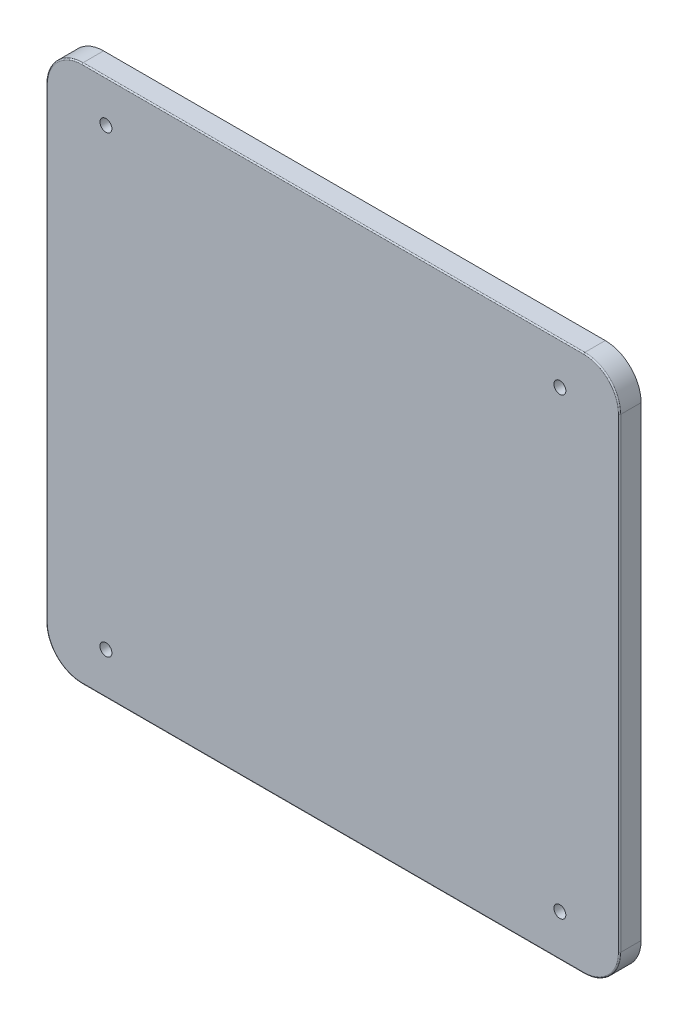
from build123d import *

# Parameters (mm, degrees)
P_IDAT_VYSUNUT_M1_DEPTH      = 18
D_RY_PRO_KOL_K_10_0MM1_D     = 10
D_RY_PRO_KOL_K_10_0MM1_DEPTH = 10
D_RY_PRO_KOL_K_10_0MM1_TIP   = 3.004303095
ZAOBLIT1_R                   = 30
ZAOBLIT2_R                   = 1


with BuildPart() as part:
    # Skica1 → Přidat vysunutím1 (new body)
    with BuildSketch(Plane.XY):
        with BuildLine():
            Line((-210, 225), (210, 225))
            ThreePointArc((210, 225), (231.213203436, 216.213203436), (240, 195))
            Line((240, 195), (240, -195))
            ThreePointArc((240, -195), (231.213203436, -216.213203436), (210, -225))
            Line((210, -225), (-240, -225))
            Line((-240, -225), (-240, 195))
            ThreePointArc((-240, 195), (-231.213203436, 216.213203436), (-210, 225))
        make_face()
    extrude(amount=P_IDAT_VYSUNUT_M1_DEPTH)

    # Díry pro kolík, Ø10.0mm1
    with Locations(Plane.XY.offset(18)):
        with Locations((-190, 190), (190, 190), (190, -190), (-190, -190)):
            Hole(D_RY_PRO_KOL_K_10_0MM1_D / 2, depth=D_RY_PRO_KOL_K_10_0MM1_DEPTH)
            with Locations((0, 0, -(D_RY_PRO_KOL_K_10_0MM1_DEPTH + D_RY_PRO_KOL_K_10_0MM1_TIP / 2))):  # 118° drill point
                Cone(0, D_RY_PRO_KOL_K_10_0MM1_D / 2, D_RY_PRO_KOL_K_10_0MM1_TIP, mode=Mode.SUBTRACT)

    # Zaoblit1
    zaoblit1_edges = [part.edges().sort_by_distance(p)[0] for p in [
        (-240, -225, 9),
    ]]
    fillet(zaoblit1_edges, radius=ZAOBLIT1_R)

    # Zaoblit2
    zaoblit2_edges = [part.edges().sort_by_distance(p)[0] for p in [
        (240, 0, 18),
        (231.213203436, 216.213203436, 18),
        (0, 225, 18),
        (-231.213203436, 216.213203436, 18),
        (-240, 0, 18),
        (0, -225, 18),
        (-231.213203436, -216.213203436, 18),
        (231.213203436, -216.213203436, 18),
    ]]
    fillet(zaoblit2_edges, radius=ZAOBLIT2_R)


solid = part.part
